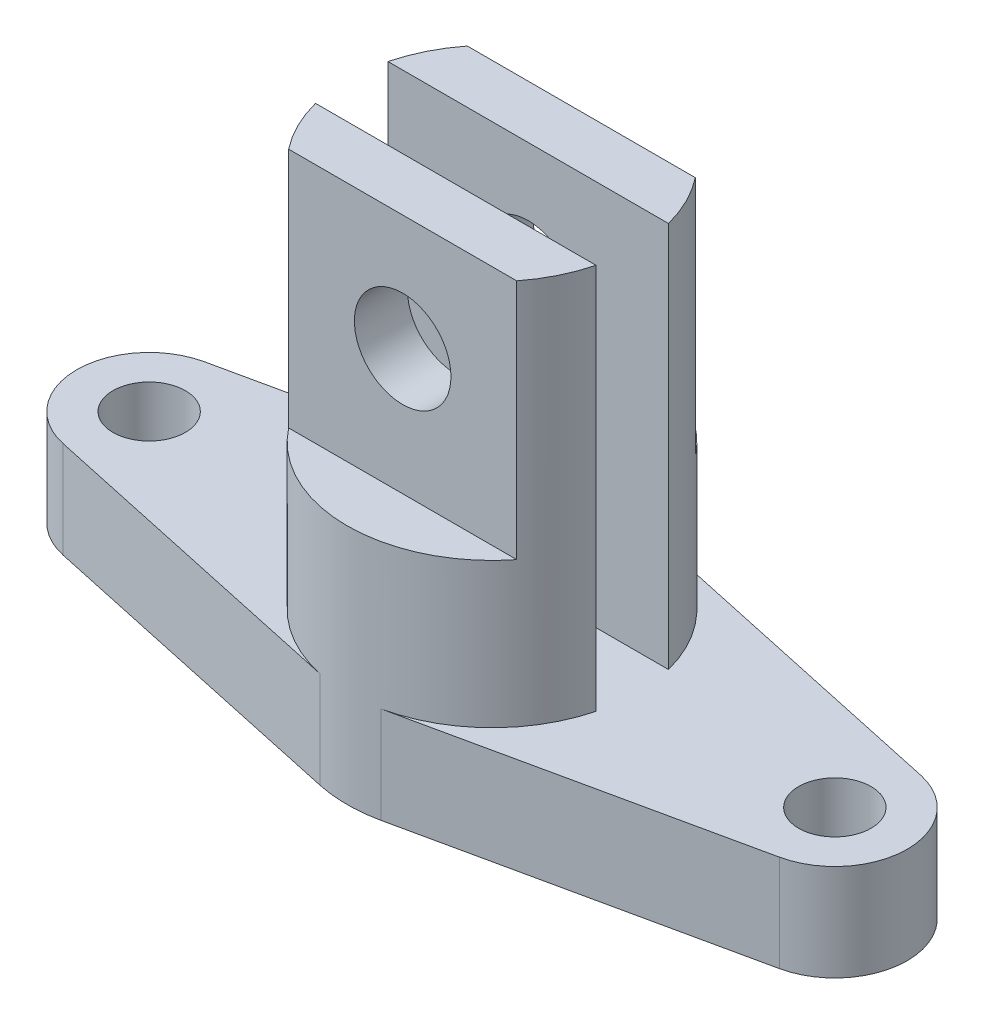
from build123d import *

# Parameters (mm, degrees)
CROQUIS1_R              = 7.5
SALIENTE_EXTRUIR1_DEPTH = 20
SALIENTE_EXTRUIR2_DEPTH = 30
SALIENTE_EXTRUIR3_DEPTH = 50
CROQUIS4_R              = 10
CORTAR_EXTRUIR1_DEPTH   = 50


with BuildPart() as part:
    # Croquis1 → Saliente-Extruir1 (new body)
    with BuildSketch(Plane(origin=(0, 0, 0), x_dir=(1, 0, 0), z_dir=(0, 1, 0))):
        with BuildLine():
            Line((-6.338028169, 29.322847729), (-74.169014085, 14.661423864))
            ThreePointArc((-74.169014085, 14.661423864), (-86, 0), (-74.169014085, -14.661423864))
            Line((-74.169014085, -14.661423864), (-6.338028169, -29.322847729))
            ThreePointArc((-6.338028169, -29.322847729), (0, -30), (6.338028169, -29.322847729))
            Line((6.338028169, -29.322847729), (74.169014085, -14.661423864))
            ThreePointArc((74.169014085, -14.661423864), (86, 0), (74.169014085, 14.661423864))
            Line((74.169014085, 14.661423864), (6.338028169, 29.322847729))
            ThreePointArc((6.338028169, 29.322847729), (0, 30), (-6.338028169, 29.322847729))
        make_face()
        with Locations(Location((-71, 0, 0), (0, 0, 270))):
            Circle(CROQUIS1_R, mode=Mode.SUBTRACT)
        with Locations(Location((71, 0, 0), (0, 0, 270))):
            Circle(CROQUIS1_R, mode=Mode.SUBTRACT)
    extrude(amount=SALIENTE_EXTRUIR1_DEPTH)

    # Croquis2 → Saliente-Extruir2 (add)
    with BuildSketch(Plane(origin=(0, 20, 0), x_dir=(1, 0, 0), z_dir=(0, 1, 0))):
        with BuildLine():
            Line((29.047375097, -7.5), (-29.047375097, -7.5))
            ThreePointArc((-29.047375097, -7.5), (-20.786795371, -21.631207506), (-6.338028169, -29.322847729))
            ThreePointArc((-6.338028169, -29.322847729), (0, -30), (6.338028169, -29.322847729))
            ThreePointArc((6.338028169, -29.322847729), (20.786795371, -21.631207506), (29.047375097, -7.5))
        make_face()
        with BuildLine():
            ThreePointArc((6.338028169, 29.322847729), (0, 30), (-6.338028169, 29.322847729))
            ThreePointArc((-6.338028169, 29.322847729), (-20.786795371, 21.631207506), (-29.047375097, 7.5))
            Line((-29.047375097, 7.5), (29.047375097, 7.5))
            ThreePointArc((29.047375097, 7.5), (20.786795371, 21.631207506), (6.338028169, 29.322847729))
        make_face()
    extrude(amount=SALIENTE_EXTRUIR2_DEPTH)

    # Croquis3 → Saliente-Extruir3 (add)
    with BuildSketch(Plane(origin=(0, 50, 0), x_dir=(1, 0, 0), z_dir=(0, 1, 0))):
        with BuildLine():
            Line((29.047375097, -7.5), (-29.047375097, -7.5))
            ThreePointArc((-29.047375097, -7.5), (-26.900316488, -13.280548665), (-23.616731357, -18.5))
            Line((-23.616731357, -18.5), (23.616731357, -18.5))
            ThreePointArc((23.616731357, -18.5), (26.900316488, -13.280548665), (29.047375097, -7.5))
        make_face()
        with BuildLine():
            Line((-29.047375097, 7.5), (29.047375097, 7.5))
            ThreePointArc((29.047375097, 7.5), (26.900316488, 13.280548665), (23.616731357, 18.5))
            Line((23.616731357, 18.5), (-23.616731357, 18.5))
            ThreePointArc((-23.616731357, 18.5), (-26.900316488, 13.280548665), (-29.047375097, 7.5))
        make_face()
    extrude(amount=SALIENTE_EXTRUIR3_DEPTH)

    # Croquis4 → Cortar-Extruir1 (cut)
    with BuildSketch(Plane.XY.offset(18.5)):
        with Locations((0, 76)):
            Circle(CROQUIS4_R)
    extrude(amount=-CORTAR_EXTRUIR1_DEPTH, mode=Mode.SUBTRACT)


solid = part.part
